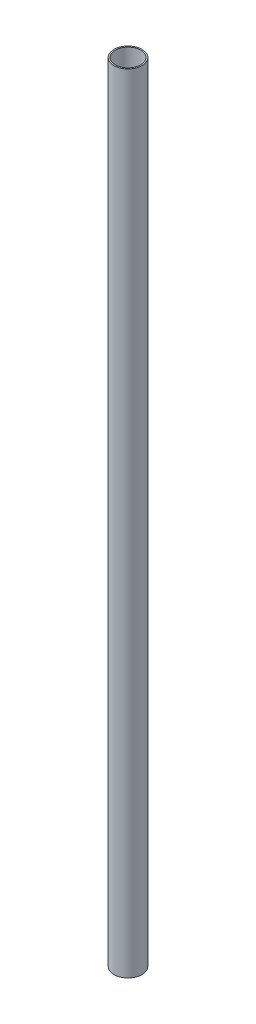
from build123d import *

# Parameters (mm, degrees)
SKETCH1_R          = 9.525
EXTRUDE1_DEPTH     = 533.4
SKETCH2_R          = 8.636
CUT_EXTRUDE1_DEPTH = 1016


with BuildPart() as part:
    # Sketch1 → Extrude1 (new body)
    with BuildSketch(Plane(origin=(0, 0, 0), x_dir=(1, 0, 0), z_dir=(0, 1, 0))):
        with Locations(Location((0, 0, 0), (0, 0, 270))):
            Circle(SKETCH1_R)
    extrude(amount=EXTRUDE1_DEPTH)

    # Sketch2 → Cut-Extrude1 (cut)
    with BuildSketch(Plane(origin=(0, 0, 0), x_dir=(1, 0, 0), z_dir=(0, 1, 0))):
        with Locations(Location((0, 0, 0), (0, 0, 270))):
            Circle(SKETCH2_R)
    extrude(amount=CUT_EXTRUDE1_DEPTH, mode=Mode.SUBTRACT)


solid = part.part
